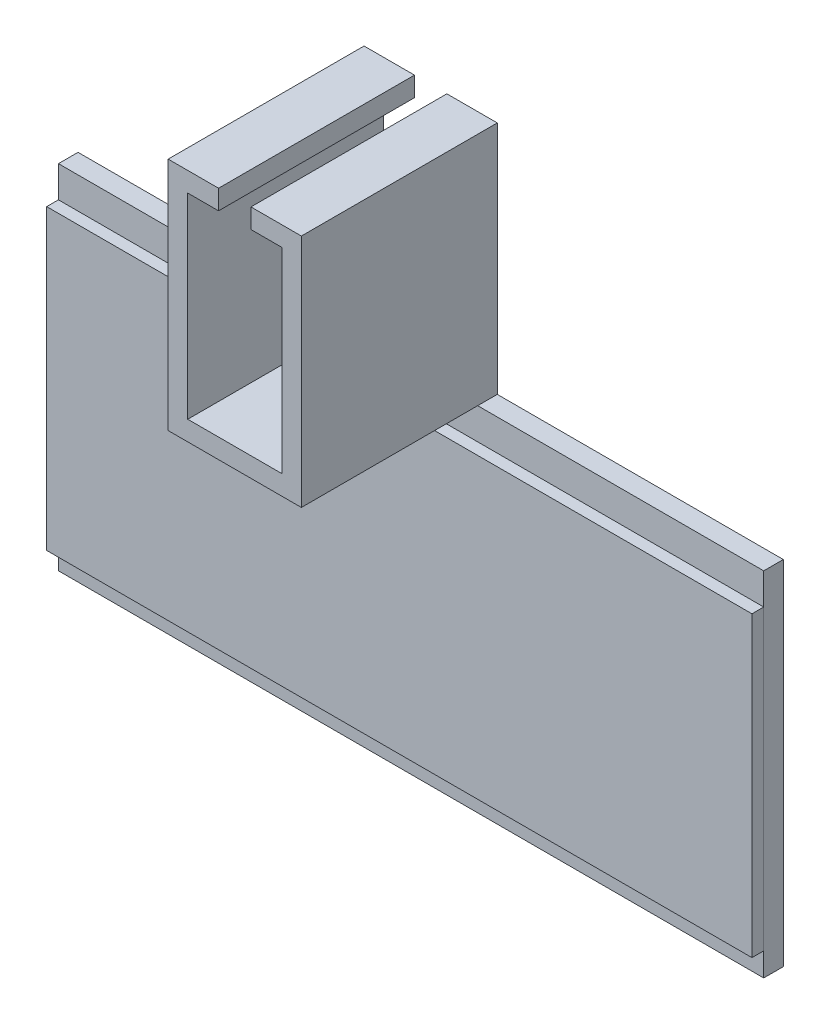
from build123d import *

# Parameters (mm, degrees)
AUFSATZ_LINEAR_AUSTRAGEN1_DEPTH = 500
SKIZZE2_W                       = 450
SKIZZE2_H                       = 900
SCHNITT_LINEAR_AUSTRAGEN1_DEPTH = 2096.829191513
SKIZZE3_W                       = 30
SKIZZE3_H                       = 760
AUFSATZ_LINEAR_AUSTRAGEN2_DEPTH = 1800


with BuildPart() as part:
    # Skizze1 → Aufsatz-Linear austragen1 (new body)
    with BuildSketch(Plane.XY):
        Polygon((-120, 0), (120, 0), (120, 500), (41.348314607, 500), (41.348314607, 550), (170, 550), (170, -50), (900, -50), (900, -950), (513.483146067, -950), (-513.483146067, -950), (-900, -950), (-900, -50), (-170, -50), (-170, 550), (-41.348314607, 550), (-41.348314607, 500), (-120, 500), align=None)
    extrude(amount=AUFSATZ_LINEAR_AUSTRAGEN1_DEPTH)

    # Skizze2 → Schnitt-Linear austragen1 (cut, through all)
    with BuildSketch(Plane(origin=(900, 0, 0), x_dir=(0, 0, -1), z_dir=(1, 0, 0))):
        with Locations((-275, -500)):
            Rectangle(SKIZZE2_W, SKIZZE2_H)
    extrude(amount=-SCHNITT_LINEAR_AUSTRAGEN1_DEPTH, mode=Mode.SUBTRACT)


with BuildPart() as body_2:
    # Skizze3 → Aufsatz-Linear austragen2 (new body)
    with BuildSketch(Plane(origin=(900, 0, 0), x_dir=(0, 0, -1), z_dir=(1, 0, 0))):
        with Locations((-65, -510)):
            Rectangle(SKIZZE3_W, SKIZZE3_H)
    extrude(amount=-AUFSATZ_LINEAR_AUSTRAGEN2_DEPTH)


solid = Compound([part.part, body_2.part])
